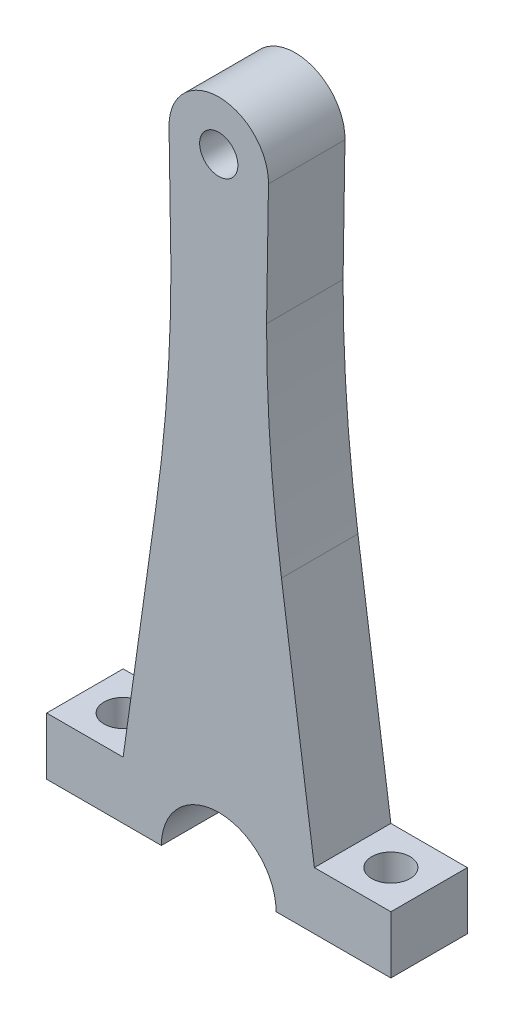
from build123d import *

# Parameters (mm, degrees)
SKETCH2_R             = 5
BOSS_EXTRUDE2_DEPTH   = 20
F_1_0MM_DOWEL_HOLE1_D = 10


with BuildPart() as part:
    # Sketch2 → Boss-Extrude2 (new body)
    with BuildSketch(Plane.XY):
        with BuildLine():
            Line((12.5, 131.912846307), (12.998411943, 163.796808069))
            ThreePointArc((12.998411943, 163.796808069), (0, 177), (-12.998411943, 163.796808069))
            Line((-12.998411943, 163.796808069), (-12.5, 131.912846307))
            ThreePointArc((-12.5, 131.912846307), (-13.474379896, 104.01025681), (-16.392772503, 76.243605923))
            Line((-16.392772503, 76.243605923), (-25, 15))
            Line((-25, 15), (-45, 15))
            Line((-45, 15), (-45, 0))
            Line((-45, 0), (-15, 0))
            ThreePointArc((-15, 0), (0, 15), (15, 0))
            Line((15, 0), (45, 0))
            Line((45, 0), (45, 15))
            Line((45, 15), (25, 15))
            Line((25, 15), (16.392772503, 76.243605923))
            ThreePointArc((16.392772503, 76.243605923), (13.474379896, 104.01025681), (12.5, 131.912846307))
        make_face()
        with Locations((0, 164)):
            Circle(SKETCH2_R, mode=Mode.SUBTRACT)
    extrude(amount=BOSS_EXTRUDE2_DEPTH)

    # Ø1.0mm Dowel Hole1 (through all)
    with Locations(Plane(origin=(0, 15, 0), x_dir=(1, 0, 0), z_dir=(0, 1, 0))):
        with Locations((-35, -10), (35, -10)):
            Hole(F_1_0MM_DOWEL_HOLE1_D / 2)


solid = part.part
